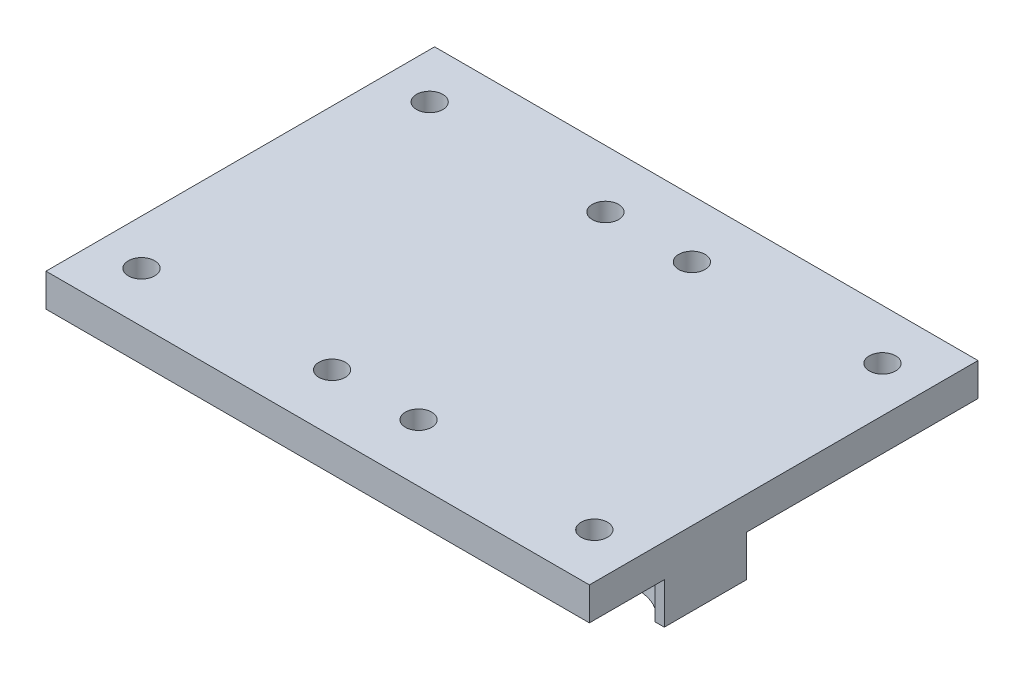
from build123d import *

# Parameters (mm, degrees)
SKETCH_7_R          = 1.6
SKETCH_7_W          = 15
SKETCH_7_H          = 10
EXTRUDE_1_DEPTH     = 4
SKETCH_8_R          = 1.6
CUT_EXTRUDE_1_DEPTH = 4
SKETCH_7_3_W        = 15
SKETCH_7_3_H        = 10
EXTRUDE_2_DEPTH     = 5
CUT_EXTRUDE_2_DEPTH = 5


with BuildPart() as part:
    # 草图7 → 凸台-拉伸1 (new body)
    # profile 1 of 3: a face of its own
    with BuildSketch(Plane(origin=(0, 0, 0), x_dir=(1, 0, 0), z_dir=(0, 1, 0))):
        Polygon((33, 23.6), (-33, 23.6), (-33, 14.5), (-18, 14.5), (-18, 4.5), (-33, 4.5), (-33, -23.6), (33, -23.6), (33, -14.5), (18, -14.5), (18, -4.5), (33, -4.5), align=None)
        with Locations(Location((-27.5, -17.5, 0), (0, 0, 270))):
            Circle(SKETCH_7_R, mode=Mode.SUBTRACT)
        with Locations(Location((27.5, -17.5, 0), (0, 0, 270))):
            Circle(SKETCH_7_R, mode=Mode.SUBTRACT)
        with Locations(Location((-27.5, 17.5, 0), (0, 0, 270))):
            Circle(SKETCH_7_R, mode=Mode.SUBTRACT)
        with Locations(Location((27.5, 17.5, 0), (0, 0, 270))):
            Circle(SKETCH_7_R, mode=Mode.SUBTRACT)
    # profile 2 of 3: a face of its own
    with BuildSketch(Plane(origin=(0, 0, 0), x_dir=(1, 0, 0), z_dir=(0, 1, 0))):
        with Locations((-25.5, 9.5)):
            Rectangle(SKETCH_7_W, SKETCH_7_H)
    # profile 3 of 3: a face of its own
    with BuildSketch(Plane(origin=(0, 0, 0), x_dir=(1, 0, 0), z_dir=(0, 1, 0))):
        with Locations((25.5, -9.5)):
            Rectangle(SKETCH_7_W, SKETCH_7_H)
    extrude(amount=EXTRUDE_1_DEPTH)

    # 草图8 → 切除-拉伸1 (cut)
    with BuildSketch(Plane.XZ):
        with Locations(Location((-5.25, -16.6, 0), (0, 0, 270))):
            Circle(SKETCH_8_R)
        with Locations(Location((5.25, -16.6, 0), (0, 0, 270))):
            Circle(SKETCH_8_R)
        with Locations(Location((-5.25, 16.6, 0), (0, 0, 90))):
            Circle(SKETCH_8_R)
        with Locations(Location((5.25, 16.6, 0), (0, 0, 90))):
            Circle(SKETCH_8_R)
    extrude(amount=-CUT_EXTRUDE_1_DEPTH, mode=Mode.SUBTRACT)

    # 草图7<3> → 凸台-拉伸2 (add)
    with BuildSketch(Plane(origin=(0, 0, 0), x_dir=(1, 0, 0), z_dir=(0, 1, 0))):
        with Locations((-25.5, 9.5)):
            Rectangle(SKETCH_7_3_W, SKETCH_7_3_H)
        with Locations((25.5, -9.5)):
            Rectangle(SKETCH_7_3_W, SKETCH_7_3_H)
    extrude(amount=-EXTRUDE_2_DEPTH)

    # 草图10 → 切除-拉伸2 (cut)
    with BuildSketch(Plane.XZ):
        with BuildLine():
            ThreePointArc((-23.130789545, -14.5), (-27.5, -12.2), (-31.869210455, -14.5))
            Line((-31.869210455, -14.5), (-23.130789545, -14.5))
        make_face()
        with BuildLine():
            ThreePointArc((23.130789545, 14.5), (27.5, 12.2), (31.869210455, 14.5))
            Line((31.869210455, 14.5), (23.130789545, 14.5))
        make_face()
    extrude(amount=CUT_EXTRUDE_2_DEPTH, mode=Mode.SUBTRACT)


solid = part.part
